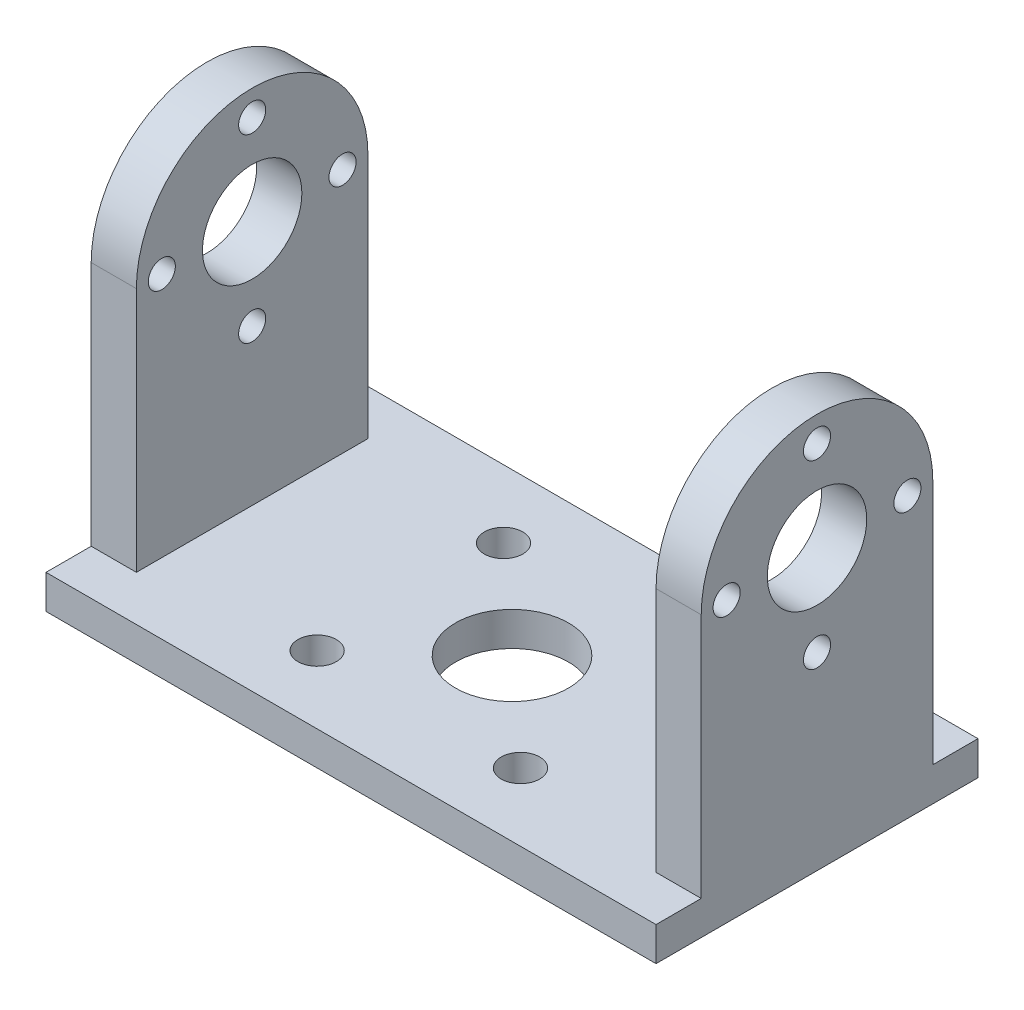
from build123d import *

# Parameters (mm, degrees)
SKETCH1_W           = 36
SKETCH1_H           = 28.5
SKETCH1_R           = 1.7
SKETCH1_R_2         = 5
SKETCH1_W_2         = 9
BOSS_EXTRUDE2_DEPTH = 3
SKETCH2_W           = 4
SKETCH2_H           = 20.5
BOSS_EXTRUDE3_DEPTH = 21.75
SKETCH4_R           = 10.25
BOSS_EXTRUDE4_DEPTH = 4
SKETCH6_R           = 4.4
SKETCH6_R_2         = 1.2
CUT_EXTRUDE3_DEPTH  = 4


with BuildPart() as part:
    # Sketch1 → Boss-Extrude2 (new body)
    # profile 1 of 3: a face of its own
    with BuildSketch(Plane(origin=(0, 0, 0), x_dir=(1, 0, 0), z_dir=(0, 1, 0))):
        Rectangle(SKETCH1_W, SKETCH1_H)
        with Locations(Location((-9, -8.25, 0), (0, 0, 270))):
            Circle(SKETCH1_R, mode=Mode.SUBTRACT)
        with Locations(Location((9, -8.25, 0), (0, 0, 270))):
            Circle(SKETCH1_R, mode=Mode.SUBTRACT)
        with Locations(Location((-9, 8.25, 0), (0, 0, 270))):
            Circle(SKETCH1_R, mode=Mode.SUBTRACT)
        with Locations(Location((0, 0, 0), (0, 0, 270))):
            Circle(SKETCH1_R_2, mode=Mode.SUBTRACT)
        with Locations(Location((9, 8.25, 0), (0, 0, 270))):
            Circle(SKETCH1_R, mode=Mode.SUBTRACT)
    # profile 2 of 3: a face of its own
    with BuildSketch(Plane(origin=(0, 0, 0), x_dir=(1, 0, 0), z_dir=(0, 1, 0))):
        with Locations((-22.5, 0)):
            Rectangle(SKETCH1_W_2, SKETCH1_H)
    # profile 3 of 3: a face of its own
    with BuildSketch(Plane(origin=(0, 0, 0), x_dir=(1, 0, 0), z_dir=(0, 1, 0))):
        with Locations((22.5, 0)):
            Rectangle(SKETCH1_W_2, SKETCH1_H)
    extrude(amount=BOSS_EXTRUDE2_DEPTH)

    # Sketch2 → Boss-Extrude3 (add)
    with BuildSketch(Plane(origin=(0, 3, 0), x_dir=(1, 0, 0), z_dir=(0, 1, 0))):
        with Locations((25, 0)):
            Rectangle(SKETCH2_W, SKETCH2_H)
    boss_extrude3 = extrude(amount=BOSS_EXTRUDE3_DEPTH)

    # Sketch4 → Boss-Extrude4 (add)
    with BuildSketch(Plane(origin=(27, 0, 0), x_dir=(0, 0, -1), z_dir=(1, 0, 0))):
        with Locations((0, 24.75)):
            Circle(SKETCH4_R)
    boss_extrude4 = extrude(amount=-BOSS_EXTRUDE4_DEPTH)

    # Mirror1: Boss-Extrude3, Boss-Extrude4 across plane
    add(boss_extrude3.mirror(Plane(origin=(0, 0, 0), x_dir=(0, 0, 1), z_dir=(1, 0, 0))))
    add(boss_extrude4.mirror(Plane(origin=(0, 0, 0), x_dir=(0, 0, 1), z_dir=(1, 0, 0))))

    # Sketch6 → Cut-Extrude3 (cut)
    with BuildSketch(Plane(origin=(27, 0, 0), x_dir=(0, 0, -1), z_dir=(1, 0, 0))):
        with Locations((0, 24.75)):
            Circle(SKETCH6_R)
        with Locations((0, 32.75)):
            Circle(SKETCH6_R_2)
        with Locations((8, 24.75)):
            Circle(SKETCH6_R_2)
        with Locations((0, 16.75)):
            Circle(SKETCH6_R_2)
        with Locations((-8, 24.75)):
            Circle(SKETCH6_R_2)
    cut_extrude3 = extrude(amount=-CUT_EXTRUDE3_DEPTH, mode=Mode.SUBTRACT)

    # Mirror3: Cut-Extrude3 across plane
    add(cut_extrude3.mirror(Plane(origin=(0, 0, 0), x_dir=(0, 0, 1), z_dir=(1, 0, 0))), mode=Mode.SUBTRACT)


solid = part.part
